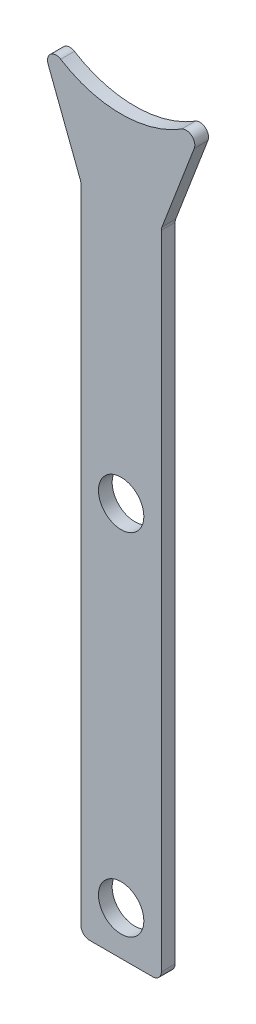
from build123d import *

# Parameters (mm, degrees)
SKETCH1_R           = 2.625
BOSS_EXTRUDE1_DEPTH = 1.5875
FILLET1_R           = 1


with BuildPart() as part:
    # Sketch1 → Boss-Extrude1 (new body)
    with BuildSketch(Plane.XY):
        with BuildLine():
            Line((-11.271295364, 58.066064539), (-6.099639673, 44.56328746))
            Line((-6.099639673, 44.56328746), (-6.099639673, -30.902312688))
            Line((-6.099639673, -30.902312688), (3.214360327, -30.902312688))
            Line((3.214360327, -30.902312688), (3.214360327, 44.56328746))
            Line((3.214360327, 44.56328746), (8.386016017, 58.066064539))
            ThreePointArc((8.386016017, 58.066064539), (-1.442639673, 53.681260746), (-11.271295364, 58.066064539))
        make_face()
        with Locations((-1.442639673, 14.68417415)):
            Circle(SKETCH1_R, mode=Mode.SUBTRACT)
        with Locations((-1.442639673, -25.828822829)):
            Circle(SKETCH1_R, mode=Mode.SUBTRACT)
    extrude(amount=BOSS_EXTRUDE1_DEPTH)

    # Fillet1
    fillet1_edges = [part.edges().sort_by_distance(p)[0] for p in [
        (3.214360327, -30.902312688, 0.79375),
        (-6.099639673, -30.902312688, 0.79375),
        (-6.099639673, 44.56328746, 0.79375),
        (-11.271295364, 58.066064539, 0.79375),
        (8.386016017, 58.066064539, 0.79375),
        (3.214360327, 44.56328746, 0.79375),
    ]]
    fillet(fillet1_edges, radius=FILLET1_R)


solid = part.part
